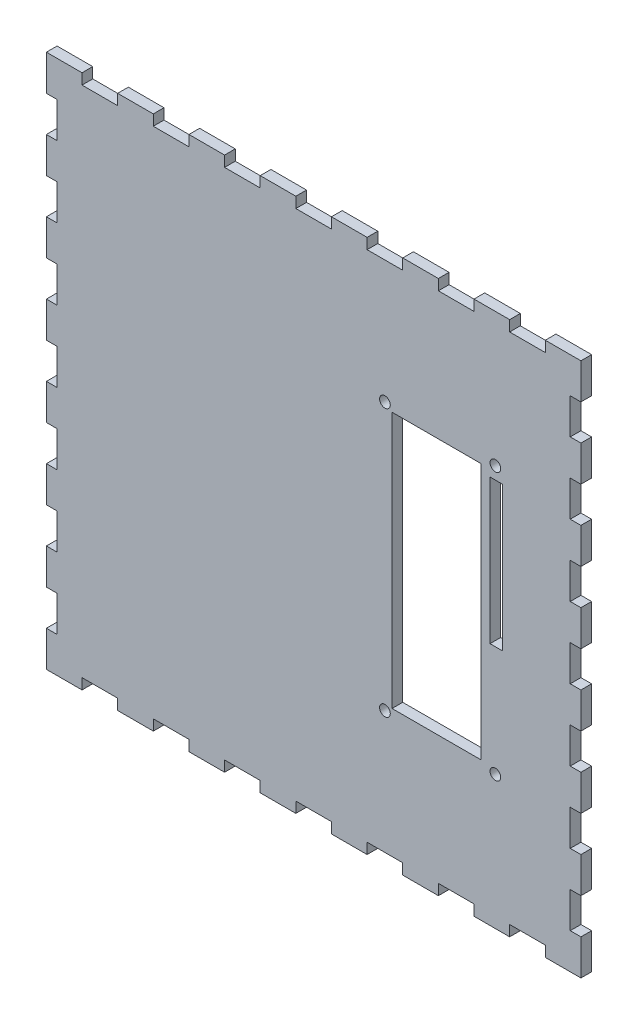
from build123d import *

# Parameters (mm, degrees)
CROQUIS1_R              = 1.5
CROQUIS1_W              = 25
CROQUIS1_H              = 72
CROQUIS1_W_2            = 3.5
CROQUIS1_H_2            = 40.5
SALIENTE_EXTRUIR1_DEPTH = 3


with BuildPart() as part:
    # Croquis1 → Saliente-Extruir1 (new body)
    with BuildSketch(Plane.XY):
        Polygon((-75, -75), (-75, -65), (-72, -65), (-72, -55), (-75, -55), (-75, -45), (-72, -45), (-72, -35), (-75, -35), (-75, -25), (-72, -25), (-72, -15), (-75, -15), (-75, -5), (-72, -5), (-72, 5), (-75, 5), (-75, 15), (-72, 15), (-72, 25), (-75, 25), (-75, 35), (-72, 35), (-72, 45), (-75, 45), (-75, 55), (-72, 55), (-72, 65), (-75, 65), (-75, 75), (-65, 75), (-65, 72), (-55, 72), (-55, 75), (-45, 75), (-45, 72), (-35, 72), (-35, 75), (-25, 75), (-25, 72), (-15, 72), (-15, 75), (-5, 75), (-5, 72), (5, 72), (5, 75), (15, 75), (15, 72), (25, 72), (25, 75), (35, 75), (35, 72), (45, 72), (45, 75), (55, 75), (55, 72), (65, 72), (65, 75), (75, 75), (75, 65), (72, 65), (72, 55), (75, 55), (75, 45), (72, 45), (72, 35), (75, 35), (75, 25), (72, 25), (72, 15), (75, 15), (75, 5), (72, 5), (72, -5), (75, -5), (75, -15), (72, -15), (72, -25), (75, -25), (75, -35), (72, -35), (72, -45), (75, -45), (75, -55), (72, -55), (72, -65), (75, -65), (75, -75), (65, -75), (65, -72), (55, -72), (55, -75), (45, -75), (45, -72), (35, -72), (35, -75), (25, -75), (25, -72), (15, -72), (15, -75), (5, -75), (5, -72), (-5, -72), (-5, -75), (-15, -75), (-15, -72), (-25, -72), (-25, -75), (-35, -75), (-35, -72), (-45, -72), (-45, -75), (-55, -75), (-55, -72), (-65, -72), (-65, -75), align=None)
        with Locations((20, 37.5)):
            Circle(CROQUIS1_R, mode=Mode.SUBTRACT)
        with Locations(Location((51, 37.5, 0), (0, 0, 180))):
            Circle(CROQUIS1_R, mode=Mode.SUBTRACT)
        with Locations((51, -37.5)):
            Circle(CROQUIS1_R, mode=Mode.SUBTRACT)
        with Locations(Location((20, -37.5, 0), (0, 0, 180))):
            Circle(CROQUIS1_R, mode=Mode.SUBTRACT)
        with Locations((34.5, 0)):
            Rectangle(CROQUIS1_W, CROQUIS1_H, mode=Mode.SUBTRACT)
        with Locations((51.25, 13.75)):
            Rectangle(CROQUIS1_W_2, CROQUIS1_H_2, mode=Mode.SUBTRACT)
    extrude(amount=SALIENTE_EXTRUIR1_DEPTH)


solid = part.part
